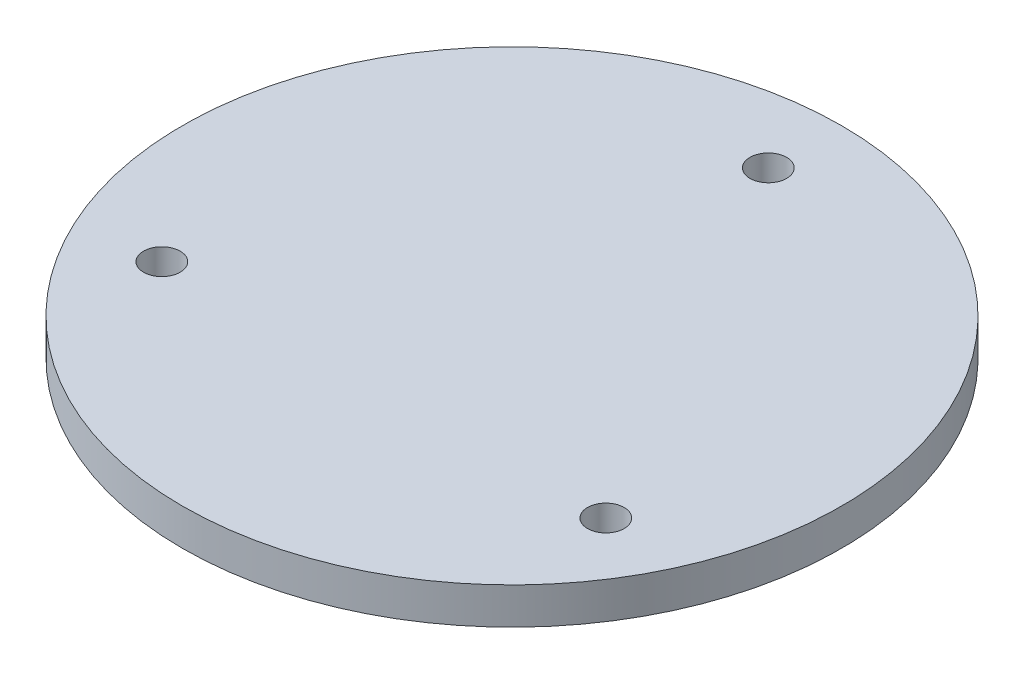
from build123d import *

# Parameters (mm, degrees)
SKETCH1_R           = 114.3
SKETCH1_R_2         = 6.35
BOSS_EXTRUDE1_DEPTH = 12.7


with BuildPart() as part:
    # Sketch1 → Boss-Extrude1 (new body)
    with BuildSketch(Plane(origin=(0, 0, 0), x_dir=(1, 0, 0), z_dir=(0, 1, 0))):
        with Locations(Location((0, 0, 0), (0, 0, 270))):
            Circle(SKETCH1_R)
        with Locations(Location((0, 88.9, 0), (0, 0, 270))):
            Circle(SKETCH1_R_2, mode=Mode.SUBTRACT)
        with Locations(Location((76.989658396, -44.45, 0), (0, 0, 270))):
            Circle(SKETCH1_R_2, mode=Mode.SUBTRACT)
        with Locations(Location((-76.989658396, -44.45, 0), (0, 0, 270))):
            Circle(SKETCH1_R_2, mode=Mode.SUBTRACT)
    extrude(amount=BOSS_EXTRUDE1_DEPTH)


solid = part.part
